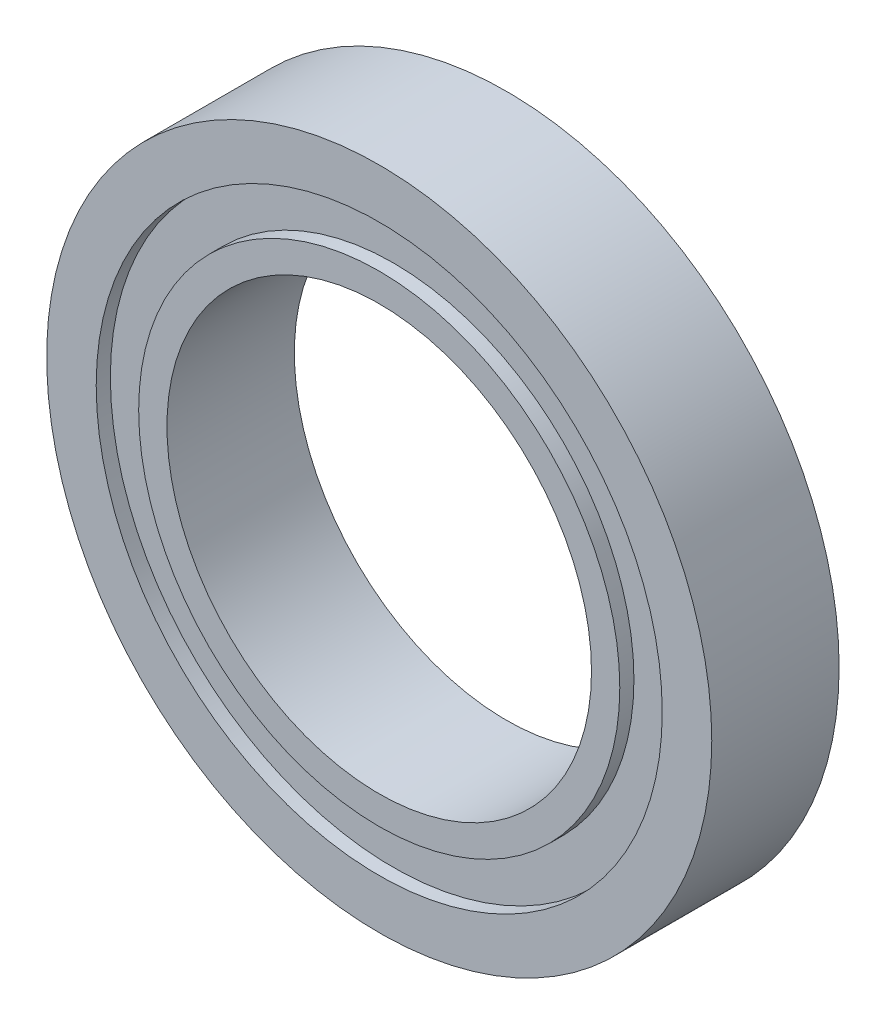
from build123d import *

# Parameters (mm, degrees)
SKETCH_1_R          = 23.5
SKETCH_1_R_2        = 15
EXTRUDE_1_DEPTH     = 9
SKETCH_2_R          = 20
SKETCH_2_R_2        = 17
CUT_EXTRUDE_1_DEPTH = 1


with BuildPart() as part:
    # 草图1 → 凸台-拉伸1 (new body)
    with BuildSketch(Plane.XY):
        Circle(SKETCH_1_R)
        Circle(SKETCH_1_R_2, mode=Mode.SUBTRACT)
    extrude(amount=EXTRUDE_1_DEPTH)

    # 草图2 → 切除-拉伸1 (cut)
    with BuildSketch(Plane.XY.offset(9)):
        Circle(SKETCH_2_R)
        Circle(SKETCH_2_R_2, mode=Mode.SUBTRACT)
    extrude(amount=-CUT_EXTRUDE_1_DEPTH, mode=Mode.SUBTRACT)


solid = part.part
